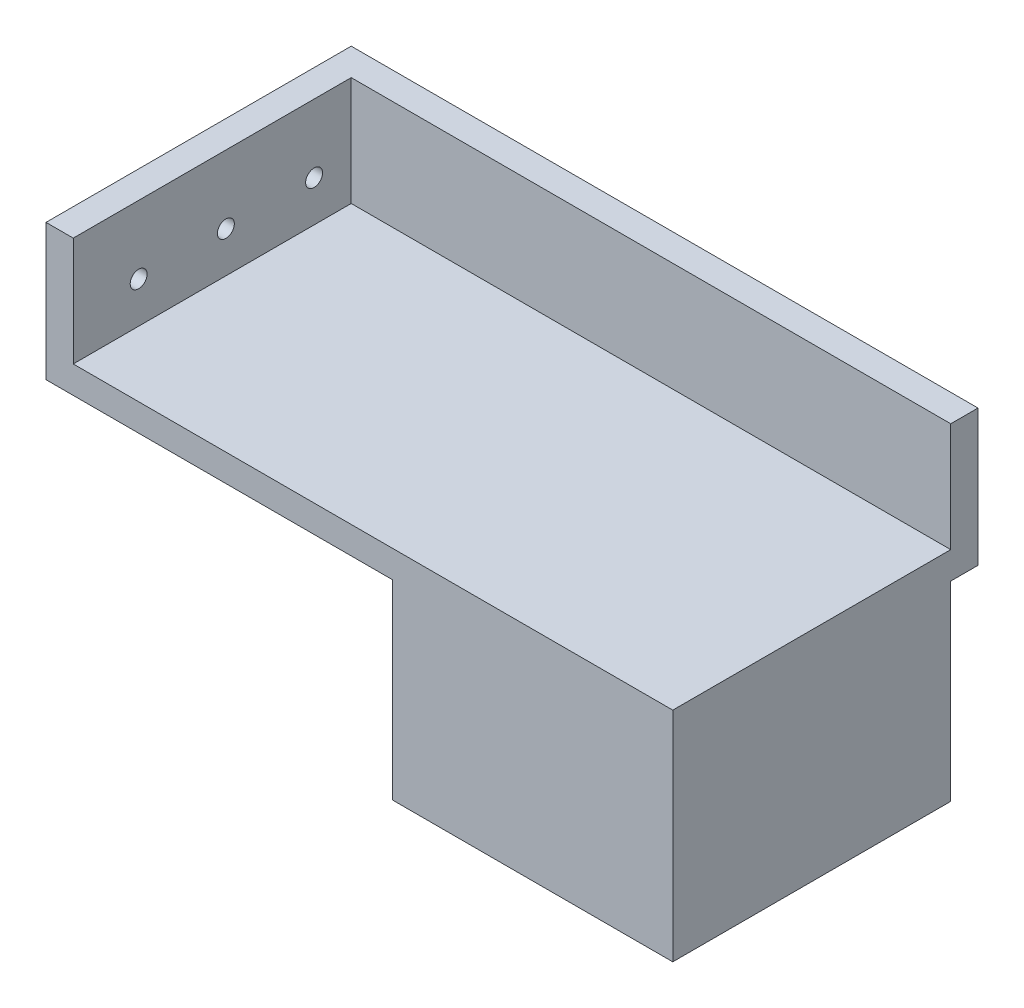
from build123d import *

# Parameters (mm, degrees)
SKETCH_1_W          = 110
SKETCH_1_H          = 51
EXTRUDE_1_DEPTH     = 5
EXTRUDE_2_DEPTH     = 25
SKETCH_3_R          = 1.55
CUT_EXTRUDE_1_DEPTH = 123.613771256
EXTRUDE_3_DEPTH     = 35


with BuildPart() as part:
    # 草图1 → 凸台-拉伸1 (new body)
    with BuildSketch(Plane(origin=(0, 0, 0), x_dir=(1, 0, 0), z_dir=(0, 1, 0))):
        with Locations((12.685483871, -8.911290323)):
            Rectangle(SKETCH_1_W, SKETCH_1_H)
    extrude(amount=EXTRUDE_1_DEPTH)



with BuildPart() as body_2:
    # 草图2 → 凸台-拉伸2 (new body)
    with BuildSketch(Plane.XZ):
        Polygon((-42.314516129, 34.411290323), (-47.314516129, 34.411290323), (-47.314516129, -16.588709677), (-47.314516129, -21.588709677), (67.685483871, -21.588709677), (67.685483871, -16.588709677), (-42.314516129, -16.588709677), align=None)
    extrude(amount=-EXTRUDE_2_DEPTH)

    # 草图3 → 切除-拉伸1 (cut, through all)
    with BuildSketch(Plane.ZY.offset(47.314516129)):
        with Locations((-9.775923567, 12.5)):
            Circle(SKETCH_3_R)
        with Locations((6.411290323, 12.5)):
            Circle(SKETCH_3_R)
        with Locations((22.411290323, 12.5)):
            Circle(SKETCH_3_R)
    extrude(amount=-CUT_EXTRUDE_1_DEPTH, mode=Mode.SUBTRACT)


with BuildPart() as part_1:
    add(part.part)

    add(body_2.part)  # 凸台-拉伸3 merges body 2
    # 草图4 → 凸台-拉伸3 (add)
    with BuildSketch(Plane.XZ):
        Polygon((67.685483871, 29.411290323), (67.685483871, 34.411290323), (62.685483871, 34.411290323), (16.301510032, 34.411290323), (16.301510032, 29.411290323), (62.685483871, 29.411290323), (62.685483871, -16.588709677), (67.685483871, -16.588709677), align=None)
    extrude(amount=EXTRUDE_3_DEPTH)


solid = part_1.part
